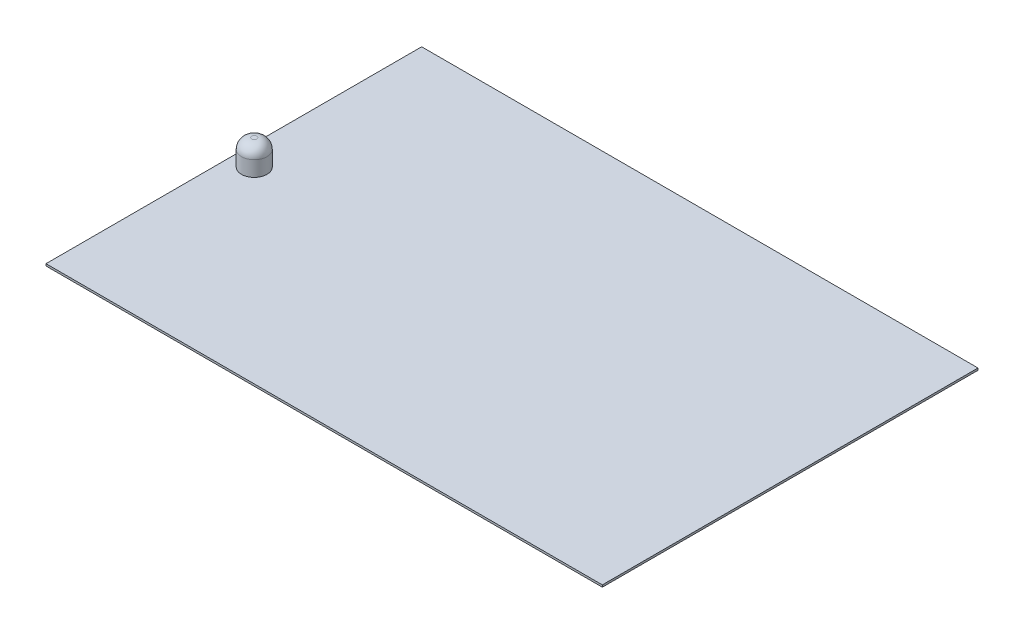
from build123d import *

# Parameters (mm, degrees)
CROQUIS1_W     = 545
CROQUIS1_H     = 368
EXTRUIR1_DEPTH = 2
CROQUIS2_R     = 12.5
EXTRUIR2_DEPTH = 25
REDONDEO1_R    = 10


with BuildPart() as part:
    # Croquis1 → Extruir1 (new body)
    with BuildSketch(Plane(origin=(0, 0, 0), x_dir=(1, 0, 0), z_dir=(0, 1, 0))):
        Rectangle(CROQUIS1_W, CROQUIS1_H)
    extrude(amount=EXTRUIR1_DEPTH)


with BuildPart() as body_2:
    # Croquis2 → Extruir2 (new body)
    with BuildSketch(Plane(origin=(0, 2, 0), x_dir=(1, 0, 0), z_dir=(0, 1, 0))):
        with Locations(Location((-252.5, 0, 0), (0, 0, 270))):
            Circle(CROQUIS2_R)
    extrude(amount=EXTRUIR2_DEPTH)

    # Redondeo1
    redondeo1_edges = [body_2.edges().sort_by_distance(p)[0] for p in [
        (-252.5, 27, -12.5),
    ]]
    fillet(redondeo1_edges, radius=REDONDEO1_R)


solid = Compound([part.part, body_2.part])
